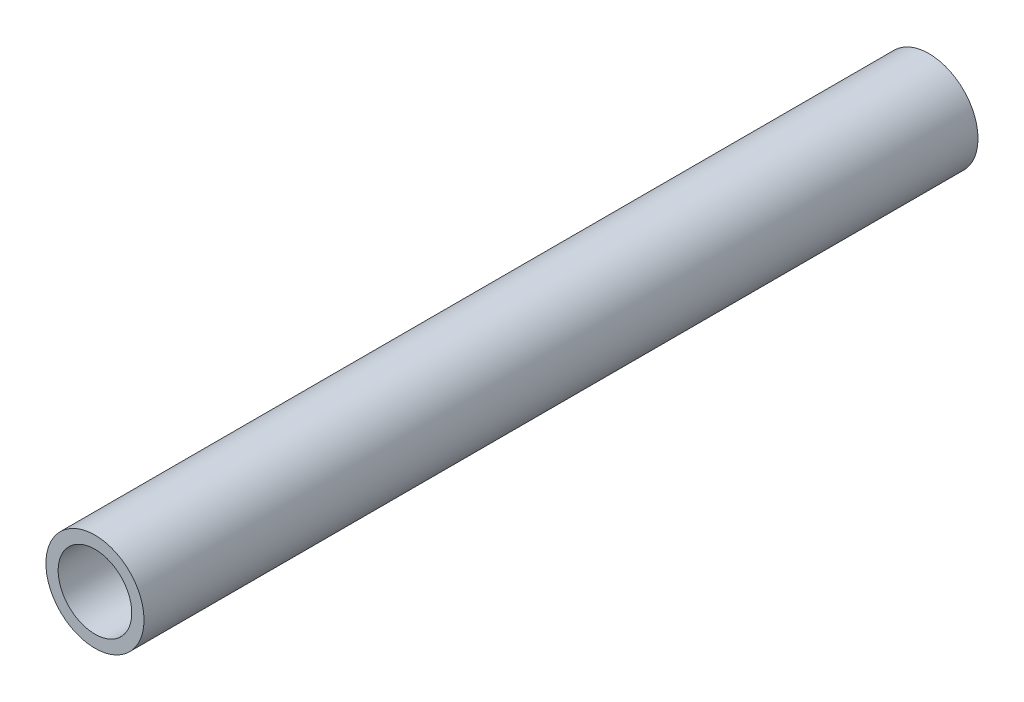
from build123d import *

# Parameters (mm, degrees)
SKETCH1_R           = 12.7
SKETCH1_R_2         = 9.525
BOSS_EXTRUDE1_DEPTH = 215.9


with BuildPart() as part:
    # Sketch1 → Boss-Extrude1 (new body)
    with BuildSketch(Plane.XY):
        Circle(SKETCH1_R)
        Circle(SKETCH1_R_2, mode=Mode.SUBTRACT)
    extrude(amount=BOSS_EXTRUDE1_DEPTH)


solid = part.part
